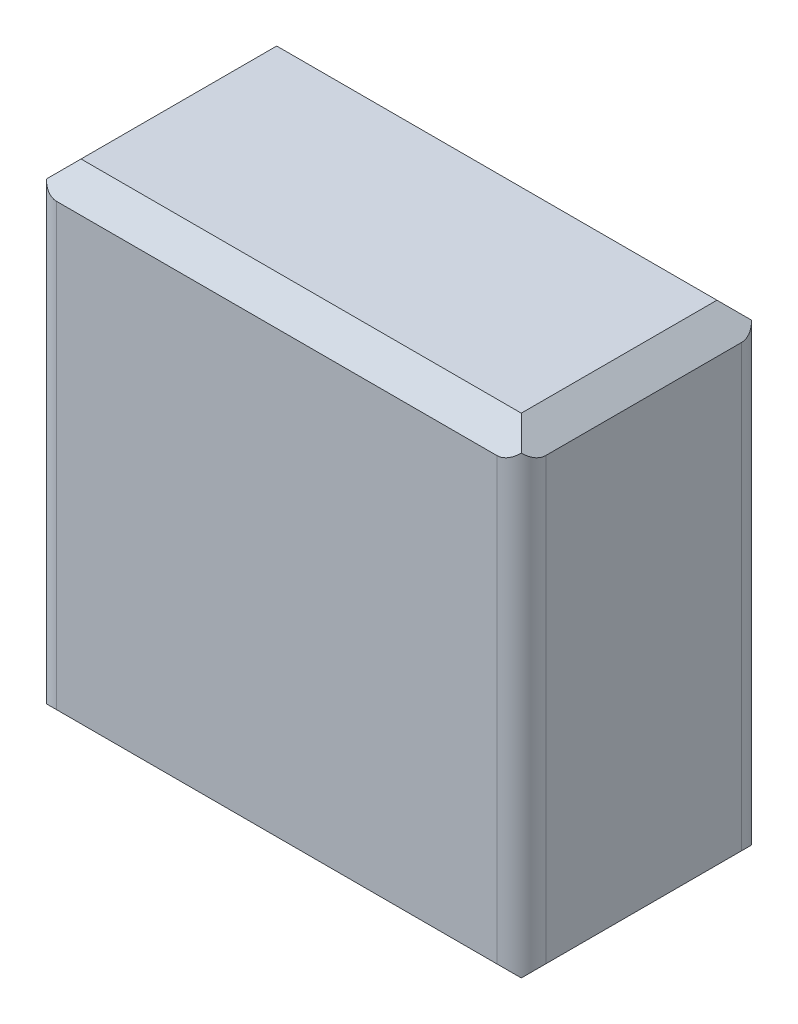
from build123d import *

# Parameters (mm, degrees)
SKETCH_1_W      = 40
SKETCH_1_H      = 40
EXTRUDE_1_DEPTH = 20
CHAMFER_2_SIZE  = 2
SKETCH_2_R      = 5
EXTRUDE_3_DEPTH = 2
SKETCH_4_R      = 2.5
EXTRUDE_6_DEPTH = 3
CHAMFER_3_SIZE  = 2
FILLET_1_R      = 2


with BuildPart() as part:
    # 草图1 → 凸台-拉伸1 (new body)
    with BuildSketch(Plane.XY):
        with Locations((-8.736097926, 20.42824298)):
            Rectangle(SKETCH_1_W, SKETCH_1_H)
    extrude(amount=EXTRUDE_1_DEPTH)

    # 倒角2
    chamfer_2_edges = [part.edges().sort_by_distance(p)[0] for p in [
        (-8.736097926, 40.42824298, 20),
        (-8.736097926, 40.42824298, 0),
        (-28.736097926, 40.42824298, 10),
        (11.263902074, 40.42824298, 10),
    ]]
    chamfer(chamfer_2_edges, length=CHAMFER_2_SIZE)

    # 草图2 → 凸台-拉伸3 (add)
    with BuildSketch(Plane(origin=(0, 0.42824298, 0), x_dir=(-1, 0, 0), z_dir=(0, -1, 0))):
        with Locations(Location((18.736097926, -10, 0), (0, 0, 270))):
            Circle(SKETCH_2_R)
    extrude(amount=EXTRUDE_3_DEPTH)

    # 草图4 → 凸台-拉伸6 (add)
    with BuildSketch(Plane.XZ.offset(1.57175702)):
        with Locations(Location((-18.736097926, 10, 0), (0, 0, 270))):
            Circle(SKETCH_4_R)
    extrude(amount=EXTRUDE_6_DEPTH)

    # 倒角3
    chamfer_3_edges = [part.edges().sort_by_distance(p)[0] for p in [
        (-8.736097926, 0.42824298, 20),
        (-8.736097926, 0.42824298, 0),
        (-28.736097926, 0.42824298, 10),
        (11.263902074, 0.42824298, 10),
    ]]
    chamfer(chamfer_3_edges, length=CHAMFER_3_SIZE)

    # 圆角1
    fillet_1_edges = [part.edges().sort_by_distance(p)[0] for p in [
        (11.263902074, 20.42824298, 0),
        (11.263902074, 20.42824298, 20),
        (-28.736097926, 20.42824298, 0),
        (-28.736097926, 20.42824298, 20),
    ]]
    fillet(fillet_1_edges, radius=FILLET_1_R)


solid = part.part
